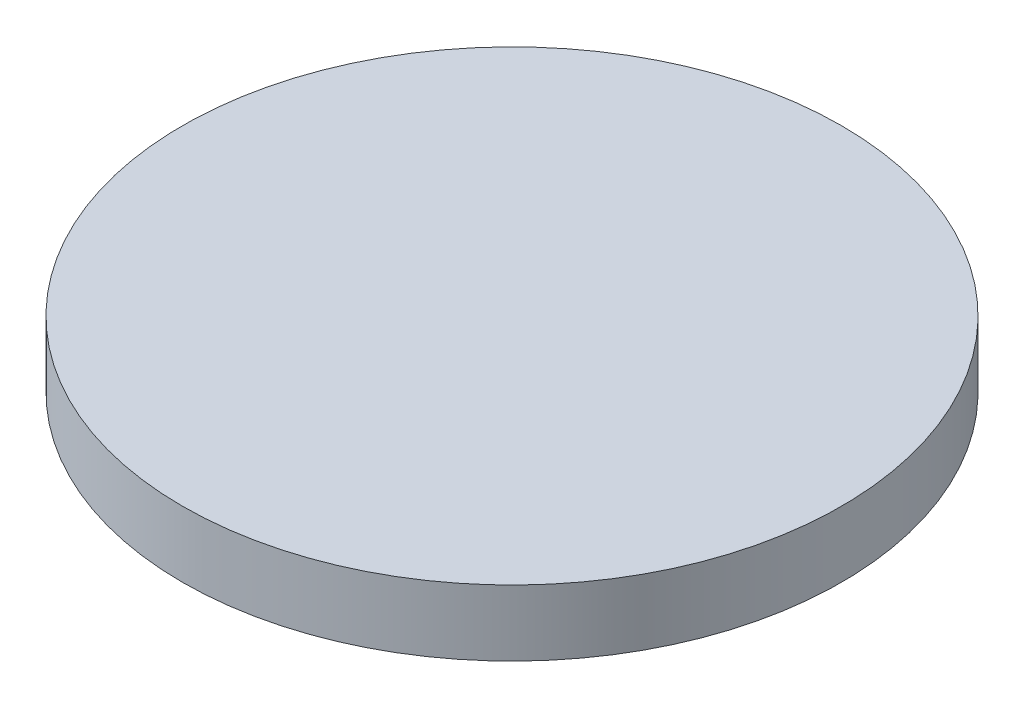
from build123d import *

# Parameters (mm, degrees)
SKETCH1_R           = 20
BOSS_EXTRUDE1_DEPTH = 4
SKETCH2_R           = 1
CUT_EXTRUDE1_DEPTH  = 0.5


with BuildPart() as part:
    # Sketch1 → Boss-Extrude1 (new body)
    with BuildSketch(Plane(origin=(0, 0, 0), x_dir=(1, 0, 0), z_dir=(0, 1, 0))):
        with Locations(Location((0, 0, 0), (0, 0, 270))):
            Circle(SKETCH1_R)
    extrude(amount=BOSS_EXTRUDE1_DEPTH)

    # Sketch2 → Cut-Extrude1 (cut)
    with BuildSketch(Plane(origin=(0, 0, 0), x_dir=(-1, 0, 0), z_dir=(0, -1, 0))):
        with Locations(Location((0, 0, 0), (0, 0, 90))):
            Circle(SKETCH2_R)
    extrude(amount=-CUT_EXTRUDE1_DEPTH, mode=Mode.SUBTRACT)


solid = part.part
